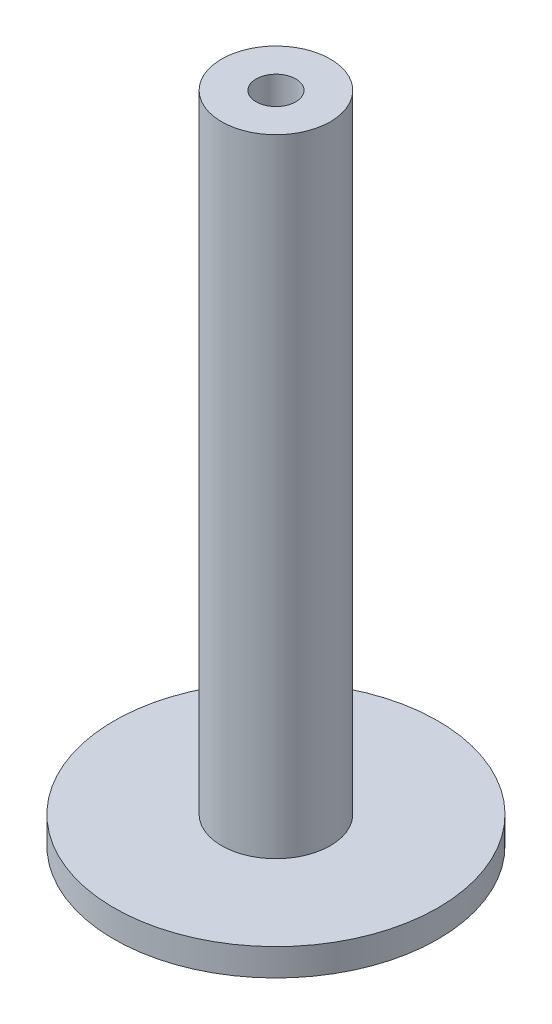
from build123d import *

# Parameters (mm, degrees)
SCHIZZO1_R                = 7.75
SCHIZZO1_R_2              = 0.95
ESTRUSIONE_SOTTILE2_DEPTH = 1.3
SCHIZZO3_R                = 2.6
SCHIZZO3_R_2              = 0.95
ESTRUSIONE_SOTTILE3_DEPTH = 30


with BuildPart() as part:
    # Schizzo1 → Estrusione-Sottile2 (new body)
    with BuildSketch(Plane(origin=(0, 0, 0), x_dir=(1, 0, 0), z_dir=(0, 1, 0))):
        Circle(SCHIZZO1_R)
        Circle(SCHIZZO1_R_2, mode=Mode.SUBTRACT)
    extrude(amount=ESTRUSIONE_SOTTILE2_DEPTH)

    # Schizzo3 → Estrusione-Sottile3 (add)
    with BuildSketch(Plane(origin=(0, 1.3, 0), x_dir=(1, 0, 0), z_dir=(0, 1, 0))):
        Circle(SCHIZZO3_R)
        Circle(SCHIZZO3_R_2, mode=Mode.SUBTRACT)
    extrude(amount=ESTRUSIONE_SOTTILE3_DEPTH)


solid = part.part
